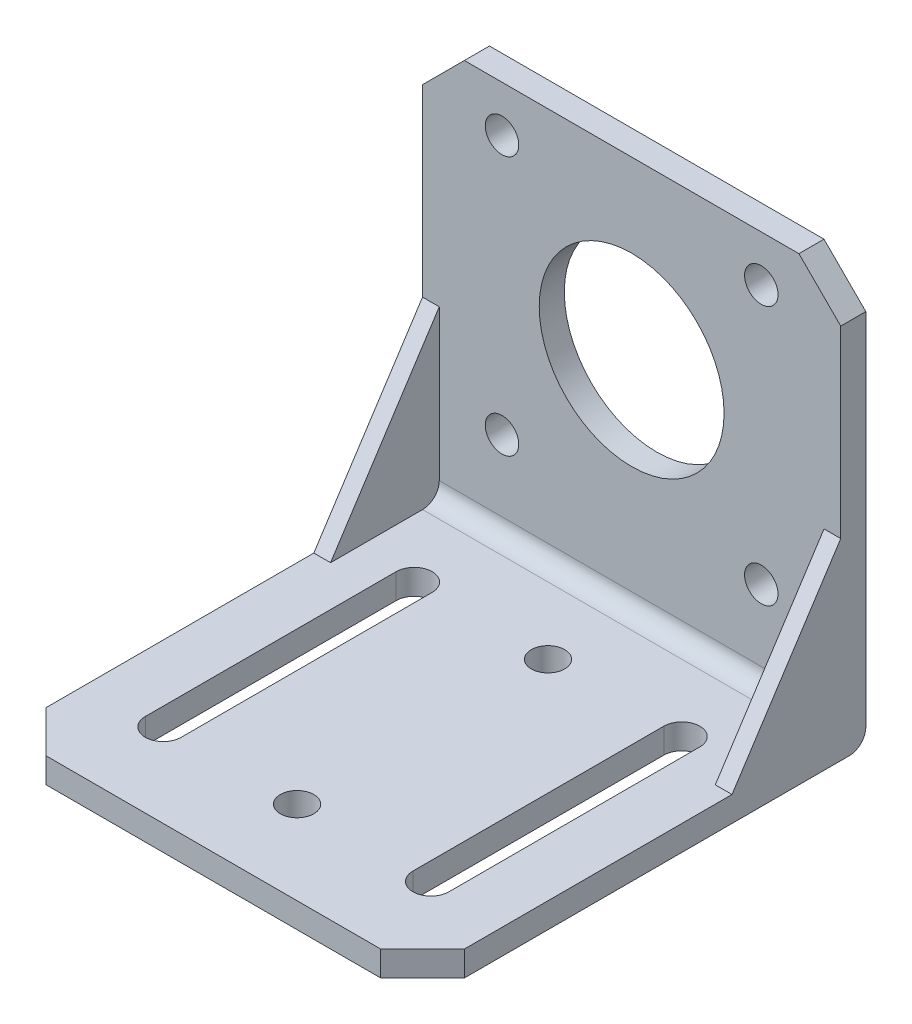
from build123d import *

# Parameters (mm, degrees)
SALIENTE_EXTRUIR1_DEPTH = 25
NERVIO1_REACH           = 90.369
CROQUIS3_WALL_W         = 202.590813764
CROQUIS3_WALL_H         = 2
REDONDEO1_R             = 2
CROQUIS4_R              = 11.05
CROQUIS4_R_2            = 2
CORTAR_EXTRUIR1_DEPTH   = 76
CHAFL_N1_SIZE           = 5
CORTAR_EXTRUIR2_DEPTH   = 76.119904153
CROQUIS6_R              = 2
CORTAR_EXTRUIR3_DEPTH   = 76.119904153


with BuildPart() as part:
    # Croquis2 → Saliente-Extruir1 (new, symmetric)
    with BuildSketch(Plane(origin=(0, 0, 0), x_dir=(0, 0, -1), z_dir=(1, 0, 0))):
        Polygon((0, 0), (-53, 0), (-53, 3), (-3, 3), (-3, 50), (0, 50), align=None)
    extrude(amount=SALIENTE_EXTRUIR1_DEPTH, both=True)

    # Croquis3 wall → Nervio1 (add, up to next)
    with BuildSketch(Plane(origin=(25, 13, 9.5), x_dir=(0, 0.838443616301, -0.544988350595), z_dir=(0, 0.544988350595, 0.838443616301)), mode=Mode.PRIVATE) as nervio1_sk1:
        with Locations((0, 1)):
            Rectangle(CROQUIS3_WALL_W, CROQUIS3_WALL_H)
    nervio1_tool1 = extrude(nervio1_sk1.sketch, amount=-NERVIO1_REACH, mode=Mode.PRIVATE) - part.part
    nervio1 = nervio1_tool1.solids().sort_by_distance((25, 13, 9.5))[0]
    add(nervio1)

    # Simetría1: Nervio1 across plane
    add(nervio1.mirror(Plane(origin=(0, 0, 0), x_dir=(0, 0, 1), z_dir=(1, 0, 0))))

    # Redondeo1
    redondeo1_edges = [part.edges().sort_by_distance(p)[0] for p in [
        (0, 0, 0),
        (0, 3, 3),
    ]]
    fillet(redondeo1_edges, radius=REDONDEO1_R)

    # Croquis4 → Cortar-Extruir1 (cut, through all)
    with BuildSketch(Plane.XY.offset(3)):
        with Locations((0, 29)):
            Circle(CROQUIS4_R)
        with Locations((-15.5, 44.5)):
            Circle(CROQUIS4_R_2)
        with Locations(Location((15.5, 44.5, 0), (0, 0, 180))):
            Circle(CROQUIS4_R_2)
        with Locations(Location((-15.5, 13.5, 0), (0, 0, 180))):
            Circle(CROQUIS4_R_2)
        with Locations((15.5, 13.5)):
            Circle(CROQUIS4_R_2)
    extrude(amount=-CORTAR_EXTRUIR1_DEPTH, mode=Mode.SUBTRACT)

    # Chaflán1
    chafl_n1_edges = [part.edges().sort_by_distance(p)[0] for p in [
        (25, 1.5, 53),
        (-25, 1.5, 53),
        (-25, 50, 1.5),
        (25, 50, 1.5),
    ]]
    chamfer(chafl_n1_edges, length=CHAFL_N1_SIZE)

    # Croquis5 → Cortar-Extruir2 (cut, through all)
    with BuildSketch(Plane(origin=(0, 3, 0), x_dir=(1, 0, 0), z_dir=(0, 1, 0))):
        with BuildLine():
            Line((-13.85, -13), (-13.85, -43))
            ThreePointArc((-13.85, -43), (-16, -45.15), (-18.15, -43))
            Line((-18.15, -43), (-18.15, -13))
            ThreePointArc((-18.15, -13), (-16, -10.85), (-13.85, -13))
        make_face()
        with BuildLine():
            Line((13.85, -13), (13.85, -43))
            ThreePointArc((13.85, -43), (16, -45.15), (18.15, -43))
            Line((18.15, -43), (18.15, -13))
            ThreePointArc((18.15, -13), (16, -10.85), (13.85, -13))
        make_face()
    extrude(amount=-CORTAR_EXTRUIR2_DEPTH, mode=Mode.SUBTRACT)

    # Croquis6 → Cortar-Extruir3 (cut, through all)
    with BuildSketch(Plane(origin=(0, 3, 0), x_dir=(1, 0, 0), z_dir=(0, 1, 0))):
        with Locations(Location((0, -13, 0), (0, 0, 270))):
            Circle(CROQUIS6_R)
        with Locations(Location((0, -43, 0), (0, 0, 90))):
            Circle(CROQUIS6_R)
    extrude(amount=-CORTAR_EXTRUIR3_DEPTH, mode=Mode.SUBTRACT)


solid = part.part
